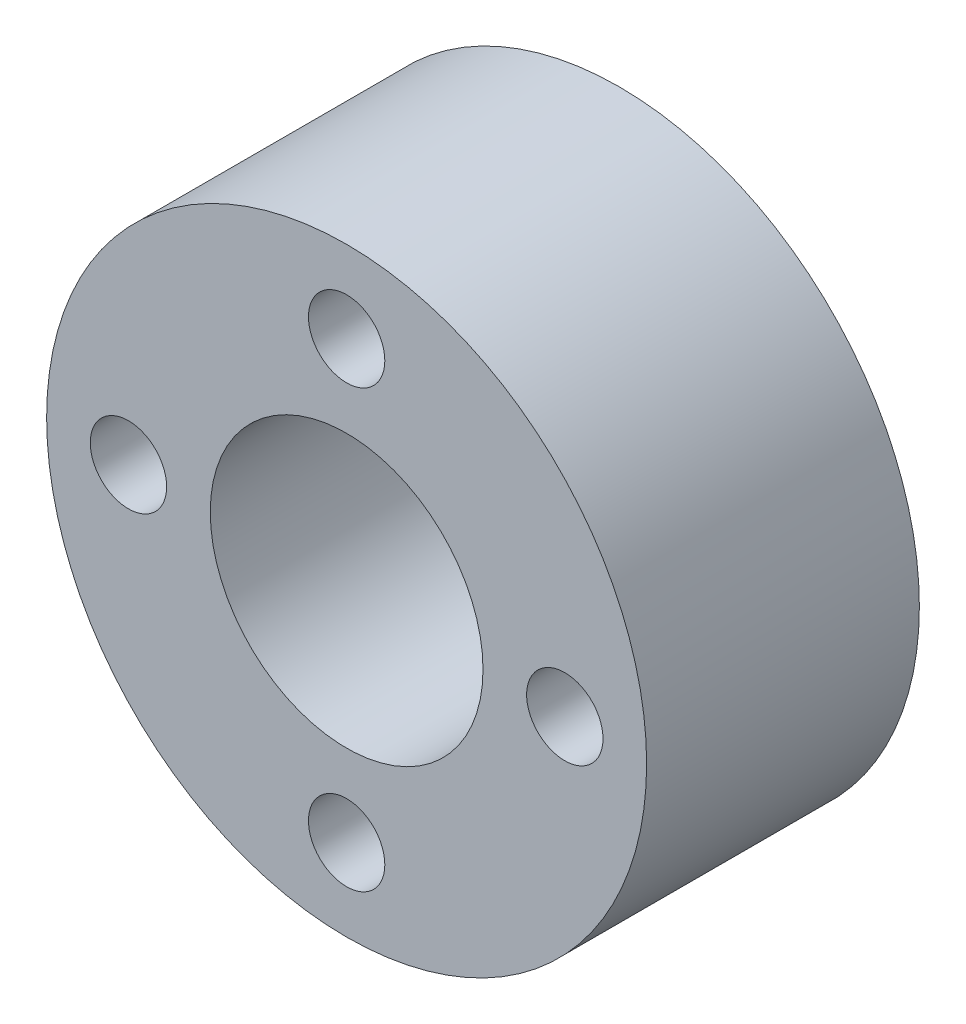
from build123d import *

# Parameters (mm, degrees)
SKETCH_1_R          = 27.5
EXTRUDE_1_DEPTH     = 25
SKETCH_2_R          = 12.5
SKETCH_2_R_2        = 3.5
CUT_EXTRUDE_1_DEPTH = 25


with BuildPart() as part:
    # 草图1 → 凸台-拉伸1 (new body)
    with BuildSketch(Plane.XY):
        Circle(SKETCH_1_R)
    extrude(amount=-EXTRUDE_1_DEPTH)

    # 草图2 → 切除-拉伸1 (cut)
    with BuildSketch(Plane.XY):
        Circle(SKETCH_2_R)
        with Locations((20, 0)):
            Circle(SKETCH_2_R_2)
        with Locations((0, 20)):
            Circle(SKETCH_2_R_2)
        with Locations((-20, 0)):
            Circle(SKETCH_2_R_2)
        with Locations((0, -20)):
            Circle(SKETCH_2_R_2)
    extrude(amount=-CUT_EXTRUDE_1_DEPTH, mode=Mode.SUBTRACT)


solid = part.part
